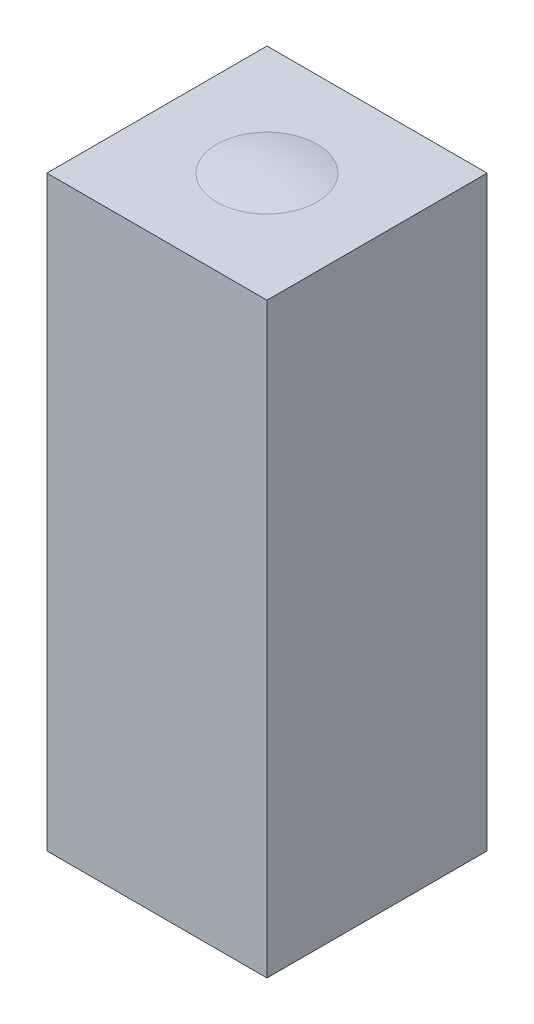
from build123d import *

# Parameters (mm, degrees)
SKETCH1_W           = 30
SKETCH1_H           = 30
BOSS_EXTRUDE1_DEPTH = 80


with BuildPart() as part:
    # Sketch1 → Boss-Extrude1 (new body)
    with BuildSketch(Plane(origin=(0, 0, 0), x_dir=(1, 0, 0), z_dir=(0, 1, 0))):
        with Locations((-27.711864407, 2.161016949)):
            Rectangle(SKETCH1_W, SKETCH1_H)
    extrude(amount=-BOSS_EXTRUDE1_DEPTH)

    # Sketch2 → Revolve4 (revolve)
    with BuildSketch(Plane(origin=(0, 0, -2.161016949), x_dir=(-1, 0, 0), z_dir=(0, 0, -1))):
        with BuildLine():
            Line((27.711864407, 0), (34.551820017, 0))
            ThreePointArc((34.551820017, 0), (31.152183546, 0.559787224), (27.711864407, 0.747121391))
            Line((27.711864407, 0.747121391), (27.711864407, 0))
        make_face()
    revolve(axis=Axis((-27.711864407, -84, -2.161016949), (0, 1, 0)))


solid = part.part
